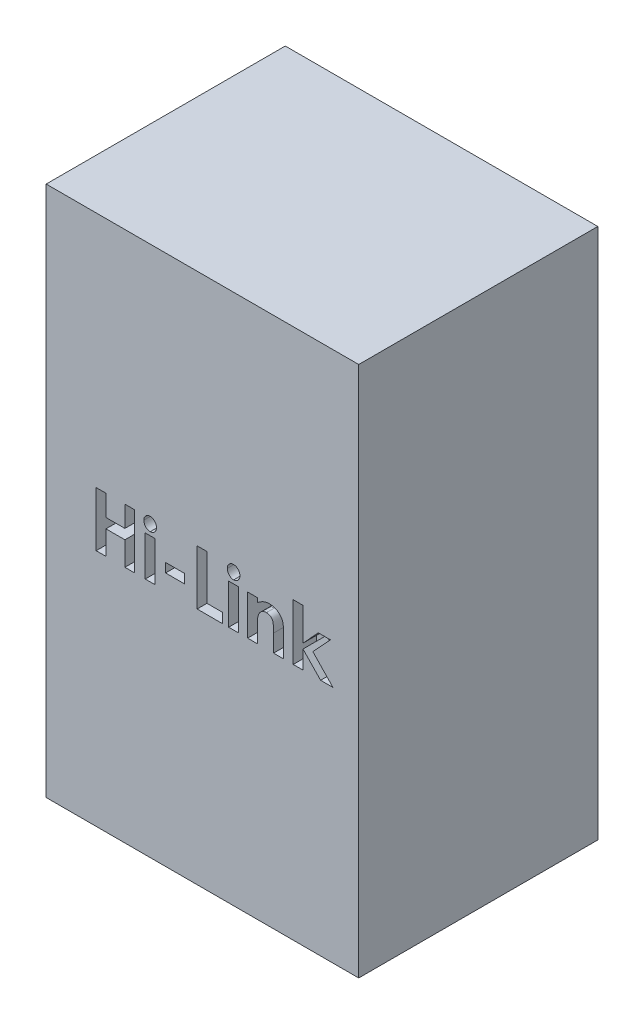
from build123d import *

# Parameters (mm, degrees)
ESBO_O1_W                = 20
ESBO_O1_H                = 34
RESSALTO_EXTRUS_O1_DEPTH = 15.3
ESBO_O2_W                = 0.628205129
ESBO_O2_H                = 2.557692308
ESBO_O2_W_2              = 1.211538461
ESBO_O2_H_2              = 0.583333334
ESBO_O2_W_3              = 0.628205128
CORTE_EXTRUS_O1_DEPTH    = 1.5


with BuildPart() as part:
    # Esboço1 → Ressalto-extrusão1 (new body)
    with BuildSketch(Plane.XY):
        with Locations((-10, 17)):
            Rectangle(ESBO_O1_W, ESBO_O1_H)
    extrude(amount=RESSALTO_EXTRUS_O1_DEPTH)

    # Esboço2 → Corte-extrusão1 (cut)
    with BuildSketch(Plane.XY.offset(15.3)):
        Polygon((-16.80198257, 18.779052447), (-16.173777441, 18.779052447), (-16.173777441, 17.432898601), (-14.96223898, 17.432898601), (-14.96223898, 18.779052447), (-14.334033852, 18.779052447), (-14.334033852, 15.279052447), (-14.96223898, 15.279052447), (-14.96223898, 16.804693473), (-16.173777441, 16.804693473), (-16.173777441, 15.279052447), (-16.80198257, 15.279052447), align=None)
        with BuildLine():
            add(Edge.make_bspline(
                [(-13.348256608, 18.913667832), (-13.321180971, 18.912339399), (-13.26801535, 18.909730892), (-13.191848363, 18.884303755), (-13.121942506, 18.844396624), (-13.060143789, 18.789643089), (-13.008745395, 18.724257353), (-12.969475113, 18.651053675), (-12.947599275, 18.569946357), (-12.944561045, 18.51391827), (-12.943008211, 18.485282415)],
                knots=[0, 0, 0, 0, 0.989868614, 1.943702388, 2.910836514, 3.924849579, 4.949916355, 5.946401046, 6.950409252, 8, 8, 8, 8], degree=3))
            add(Edge.make_bspline(
                [(-12.943008211, 18.485282415), (-12.944505487, 18.456857591), (-12.947423001, 18.401470467), (-12.969978599, 18.321464218), (-13.007672708, 18.248296095), (-13.059487397, 18.183881459), (-13.120616135, 18.130009762), (-13.188994496, 18.089378141), (-13.264431582, 18.06536551), (-13.316772234, 18.062538947), (-13.343348756, 18.061103729)],
                knots=[0, 0, 0, 0, 1.05296456, 2.051751585, 3.055639087, 4.085634717, 5.099016424, 6.062201612, 7.016062274, 8, 8, 8, 8], degree=3))
            add(Edge.make_bspline(
                [(-13.343348756, 18.061103729), (-13.37066074, 18.062427414), (-13.4242889, 18.06502652), (-13.501080613, 18.09051315), (-13.571918836, 18.130105987), (-13.63344947, 18.185978222), (-13.685436491, 18.251828573), (-13.722991431, 18.326736496), (-13.746482976, 18.408398424), (-13.749271401, 18.465256325), (-13.750700518, 18.494396998)],
                knots=[0, 0, 0, 0, 0.989065327, 1.942068821, 2.907541208, 3.917690034, 4.939857478, 5.938239964, 6.943311734, 8, 8, 8, 8], degree=3))
            add(Edge.make_bspline(
                [(-13.750700518, 18.494396998), (-13.749145248, 18.522339152), (-13.746090144, 18.57722748), (-13.724083268, 18.656531545), (-13.685713452, 18.728504555), (-13.634685286, 18.792693343), (-13.57342937, 18.846425519), (-13.503565478, 18.885120645), (-13.427911097, 18.909497568), (-13.375082261, 18.912263391), (-13.348256608, 18.913667832)],
                knots=[0, 0, 0, 0, 1.038616768, 2.040212704, 3.031499824, 4.052181184, 5.074969369, 6.039807101, 7.004644834, 8, 8, 8, 8], degree=3))
        make_face()
        with Locations((-13.346854365, 16.557898601)):
            Rectangle(ESBO_O2_W, ESBO_O2_H)
        with Locations((-11.753905647, 16.557898601)):
            Rectangle(ESBO_O2_W_2, ESBO_O2_H_2)
        Polygon((-10.340444108, 18.779052447), (-9.71223898, 18.779052447), (-9.71223898, 15.907257575), (-8.725059493, 15.907257575), (-8.725059493, 15.279052447), (-10.340444108, 15.279052447), align=None)
        with BuildLine():
            add(Edge.make_bspline(
                [(-8.008513018, 18.913667832), (-7.981437382, 18.912339399), (-7.928271761, 18.909730892), (-7.852104774, 18.884303755), (-7.782198916, 18.844396624), (-7.720400199, 18.789643089), (-7.669001805, 18.724257353), (-7.629731523, 18.651053675), (-7.607855685, 18.569946357), (-7.604817455, 18.51391827), (-7.603264621, 18.485282415)],
                knots=[0, 0, 0, 0, 0.989868614, 1.943702388, 2.910836514, 3.924849579, 4.949916355, 5.946401046, 6.950409252, 8, 8, 8, 8], degree=3))
            add(Edge.make_bspline(
                [(-7.603264621, 18.485282415), (-7.604761897, 18.456857591), (-7.607679411, 18.401470467), (-7.630235009, 18.321464218), (-7.667929118, 18.248296095), (-7.719743807, 18.183881459), (-7.780872545, 18.130009762), (-7.849250906, 18.089378141), (-7.924687993, 18.06536551), (-7.977028644, 18.062538947), (-8.003605166, 18.061103729)],
                knots=[0, 0, 0, 0, 1.05296456, 2.051751585, 3.055639087, 4.085634717, 5.099016424, 6.062201612, 7.016062274, 8, 8, 8, 8], degree=3))
            add(Edge.make_bspline(
                [(-8.003605166, 18.061103729), (-8.03091715, 18.062427414), (-8.08454531, 18.06502652), (-8.161337023, 18.09051315), (-8.232175246, 18.130105987), (-8.293705881, 18.185978222), (-8.345692901, 18.251828573), (-8.383247842, 18.326736496), (-8.406739386, 18.408398424), (-8.409527811, 18.465256325), (-8.410956929, 18.494396998)],
                knots=[0, 0, 0, 0, 0.989065327, 1.942068821, 2.907541208, 3.917690034, 4.939857478, 5.938239964, 6.943311734, 8, 8, 8, 8], degree=3))
            add(Edge.make_bspline(
                [(-8.410956929, 18.494396998), (-8.409401658, 18.522339152), (-8.406346555, 18.57722748), (-8.384339678, 18.656531545), (-8.345969862, 18.728504555), (-8.294941696, 18.792693343), (-8.23368578, 18.846425519), (-8.163821888, 18.885120645), (-8.088167507, 18.909497568), (-8.035338671, 18.912263391), (-8.008513018, 18.913667832)],
                knots=[0, 0, 0, 0, 1.038616768, 2.040212704, 3.031499824, 4.052181184, 5.074969369, 6.039807101, 7.004644834, 8, 8, 8, 8], degree=3))
        make_face()
        with Locations((-8.007110775, 16.557898601)):
            Rectangle(ESBO_O2_W_3, ESBO_O2_H)
        with BuildLine():
            Line((-7.109674877, 17.836744755), (-6.481469749, 17.836744755))
            Line((-6.481469749, 17.836744755), (-6.481469749, 17.566111742))
            add(Edge.make_bspline(
                [(-6.481469749, 17.566111742), (-6.445630958, 17.593987892), (-6.377136061, 17.647264633), (-6.273011992, 17.71519275), (-6.174731762, 17.770789186), (-6.0801046, 17.81307868), (-5.987350094, 17.843504153), (-5.894966016, 17.86536304), (-5.801576583, 17.879359886), (-5.738796215, 17.880864732), (-5.707431288, 17.88161655)],
                knots=[0, 0, 0, 0, 1.276643801, 2.439914479, 3.493451431, 4.44993799, 5.350072675, 6.235028322, 7.118224225, 8, 8, 8, 8], degree=3))
            add(Edge.make_bspline(
                [(-5.707431288, 17.88161655), (-5.67561579, 17.880757378), (-5.613159296, 17.879070751), (-5.52119555, 17.867274166), (-5.433333122, 17.845788847), (-5.348584071, 17.817262154), (-5.267810997, 17.779608556), (-5.190024382, 17.734901017), (-5.116895054, 17.68044421), (-5.071858776, 17.638972521), (-5.049077922, 17.617994755)],
                knots=[0, 0, 0, 0, 1.048836932, 2.058954983, 3.049370783, 4.026390553, 5.001981509, 5.982488534, 6.97947532, 8, 8, 8, 8], degree=3))
            add(Edge.make_bspline(
                [(-5.049077922, 17.617994755), (-5.030806839, 17.5985545), (-4.99413095, 17.559531712), (-4.947978953, 17.492753726), (-4.908375347, 17.419953499), (-4.875925695, 17.340291256), (-4.85194671, 17.253329305), (-4.83349935, 17.160118021), (-4.823148214, 17.060135491), (-4.821870317, 16.991448437), (-4.821213339, 16.956135781)],
                knots=[0, 0, 0, 0, 0.889584746, 1.785680191, 2.700364693, 3.65222533, 4.649950538, 5.707241244, 6.821271309, 8, 8, 8, 8], degree=3))
            Line((-4.821213339, 16.956135781), (-4.821213339, 15.279052447))
            Line((-4.821213339, 15.279052447), (-5.449418467, 15.279052447))
            Line((-5.449418467, 15.279052447), (-5.449418467, 16.38962937))
            add(Edge.make_bspline(
                [(-5.449418467, 16.38962937), (-5.449551319, 16.425854455), (-5.449805904, 16.495273106), (-5.451760555, 16.594621628), (-5.455577174, 16.684346245), (-5.459055922, 16.764610319), (-5.465886088, 16.83512886), (-5.472045642, 16.896348304), (-5.48149688, 16.947713262), (-5.493794475, 17.002963982), (-5.515269103, 17.062119982), (-5.548607417, 17.1244506), (-5.590901743, 17.17740185), (-5.640424613, 17.221344946), (-5.697121331, 17.256107965), (-5.760306801, 17.280565915), (-5.829642274, 17.295808709), (-5.877954417, 17.297437394), (-5.903044268, 17.298283216)],
                knots=[0, 0, 0, 0, 1.49886392, 2.872294502, 4.110984203, 5.214877267, 6.195405875, 7.042225351, 7.75923308, 8.355011229, 9.382752534, 10.352059385, 11.267231453, 12.171456522, 13.078624015, 14.003401117, 14.963110155, 16, 16, 16, 16], degree=3))
            add(Edge.make_bspline(
                [(-5.903044268, 17.298283216), (-5.935674676, 17.29662852), (-5.999506096, 17.293391611), (-6.091825477, 17.268982369), (-6.176619289, 17.227469432), (-6.253194699, 17.170023876), (-6.320822389, 17.099100218), (-6.376522348, 17.01451562), (-6.422207758, 16.918311526), (-6.441853163, 16.848066911), (-6.452022634, 16.811704691)],
                knots=[0, 0, 0, 0, 0.984188326, 1.925263693, 2.85911992, 3.81709677, 4.80007086, 5.801799564, 6.862098548, 8, 8, 8, 8], degree=3))
            add(Edge.make_bspline(
                [(-6.452022634, 16.811704691), (-6.454550151, 16.800284892), (-6.460187023, 16.774816444), (-6.464822638, 16.731790285), (-6.471271114, 16.680743913), (-6.473687199, 16.620753533), (-6.477888506, 16.552103054), (-6.47944235, 16.474701653), (-6.480998974, 16.388701101), (-6.481307625, 16.328632983), (-6.481469749, 16.297081293)],
                knots=[0, 0, 0, 0, 0.543362196, 1.211806945, 2.009705693, 2.934833164, 4.000995085, 5.207458376, 6.533175157, 8, 8, 8, 8], degree=3))
            Line((-6.481469749, 16.297081293), (-6.481469749, 15.279052447))
            Line((-6.481469749, 15.279052447), (-7.109674877, 15.279052447))
            Line((-7.109674877, 15.279052447), (-7.109674877, 17.836744755))
        make_face()
        Polygon((-4.193008211, 18.868796037), (-3.564803082, 18.868796037), (-3.564803082, 16.775246357), (-2.5874393, 17.836744755), (-1.811297473, 17.836744755), (-2.933793467, 16.617493954), (-1.650740582, 15.279052447), (-2.441605967, 15.279052447), (-3.564803082, 16.450626966), (-3.564803082, 15.279052447), (-4.193008211, 15.279052447), align=None)
    extrude(amount=-CORTE_EXTRUS_O1_DEPTH, mode=Mode.SUBTRACT)


solid = part.part
